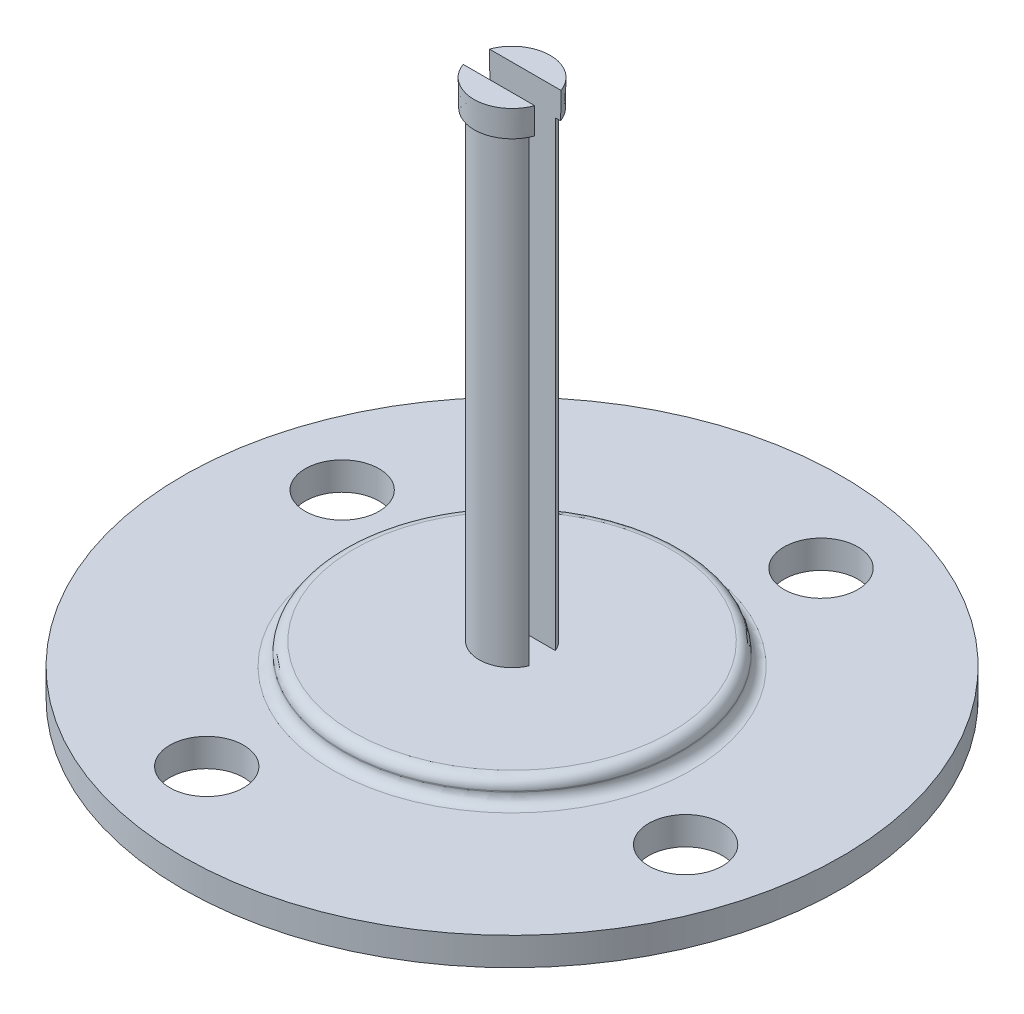
from build123d import *

# Parameters (mm, degrees)
FILLET1_R          = 1.016
SKETCH5_R          = 3.556
CUT_EXTRUDE4_DEPTH = 2.701148395
SKETCH9_W          = 105.570120157
SKETCH9_H          = 128.790829306
CUT_EXTRUDE5_DEPTH = 1.27


with BuildPart() as part:
    # Sketch1 → Revolve1 (revolve)
    with BuildSketch(Plane.XY, mode=Mode.PRIVATE) as revolve1_sk:
        Polygon((-0.172820682, 49.639122622), (-0.172820682, 0.012009488), (-0.172820682, -2.194330865), (31.577179318, -2.194330865), (31.577179318, 0.506817529), (16.121405897, 0.506817529), (16.121405897, 2.63143161), (3.002179318, 2.63143161), (3.002179318, 47.08143161), (3.46467558, 47.08143161), (3.503063095, 49.639122622), align=None)
    revolve(revolve1_sk.sketch.rotate(Axis((-0.172820682, 49.639122622, 0), (0, -1, 0)), 90), axis=Axis((-0.172820682, 49.639122622, 0), (0, -1, 0)))

    # Fillet1
    fillet1_edges = [part.edges().sort_by_distance(p)[0] for p in [
        (-0.172820682, 0.506817529, -16.294226579),
        (-0.172820682, 2.63143161, -16.294226579),
    ]]
    fillet(fillet1_edges, radius=FILLET1_R)

    # Sketch5 → Cut-Extrude4 (cut)
    with BuildSketch(Plane(origin=(0, 0.506817529, 0), x_dir=(1, 0, 0), z_dir=(0, 1, 0))):
        with Locations(Location((-23.064919044, 6.522820682, 0), (0, 0, 270))):
            Circle(SKETCH5_R)
        with Locations(Location((6.522820682, 23.064919044, 0), (0, 0, 270))):
            Circle(SKETCH5_R)
        with Locations(Location((23.064919044, -6.522820682, 0), (0, 0, 270))):
            Circle(SKETCH5_R)
        with Locations(Location((-6.522820682, -23.064919044, 0), (0, 0, 270))):
            Circle(SKETCH5_R)
    extrude(amount=-CUT_EXTRUDE4_DEPTH, mode=Mode.SUBTRACT)

    # Sketch9 → Cut-Extrude5 (cut, symmetric)
    with BuildSketch(Plane.XY):
        with Locations((-17.353763652, 67.026846263)):
            Rectangle(SKETCH9_W, SKETCH9_H)
    extrude(amount=CUT_EXTRUDE5_DEPTH, both=True, mode=Mode.SUBTRACT)


solid = part.part
